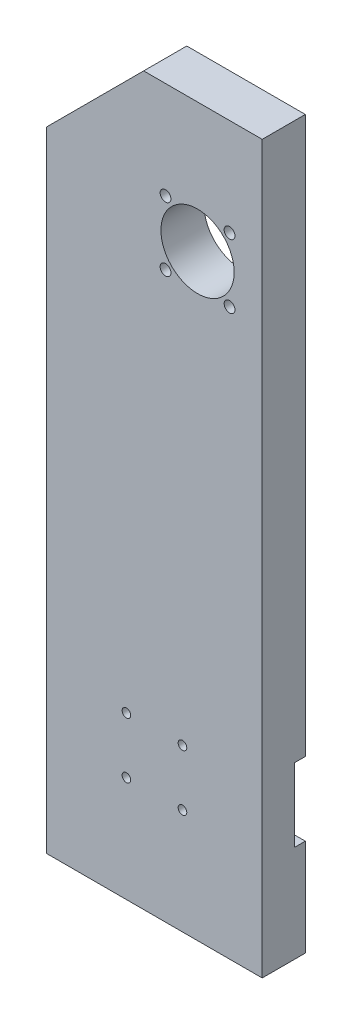
from build123d import *

# Parameters (mm, degrees)
SKETCH1_W           = 100
SKETCH1_H           = 337
SKETCH1_R           = 17
SKETCH1_R_2         = 2.5
SKETCH1_R_3         = 2
BOSS_EXTRUDE1_DEPTH = 20
CHAMFER1_SIZE       = 45
SKETCH2_W           = 100
SKETCH2_H           = 34
CUT_EXTRUDE1_DEPTH  = 5


with BuildPart() as part:
    # Sketch1 → Boss-Extrude1 (new body)
    with BuildSketch(Plane.XY):
        with Locations((47.704546062, 452.000370419)):
            Rectangle(SKETCH1_W, SKETCH1_H)
        with Locations((67.704546062, 560.500370419)):
            Circle(SKETCH1_R, mode=Mode.SUBTRACT)
        with Locations((82.553788467, 575.349612824)):
            Circle(SKETCH1_R_2, mode=Mode.SUBTRACT)
        with Locations((82.553788467, 545.651128014)):
            Circle(SKETCH1_R_2, mode=Mode.SUBTRACT)
        with Locations((52.855303657, 545.651128014)):
            Circle(SKETCH1_R_2, mode=Mode.SUBTRACT)
        with Locations((52.855303657, 575.349612824)):
            Circle(SKETCH1_R_2, mode=Mode.SUBTRACT)
        with Locations((34.704546062, 358.500370419)):
            Circle(SKETCH1_R_3, mode=Mode.SUBTRACT)
        with Locations(Location((60.704546062, 358.500370419, 0), (0, 0, 180))):
            Circle(SKETCH1_R_3, mode=Mode.SUBTRACT)
        with Locations((60.704546062, 332.500370419)):
            Circle(SKETCH1_R_3, mode=Mode.SUBTRACT)
        with Locations(Location((34.704546062, 332.500370419, 0), (0, 0, 180))):
            Circle(SKETCH1_R_3, mode=Mode.SUBTRACT)
    extrude(amount=BOSS_EXTRUDE1_DEPTH)

    # Chamfer1
    chamfer1_edges = [part.edges().sort_by_distance(p)[0] for p in [
        (-2.295453938, 620.500370419, 10),
    ]]
    chamfer(chamfer1_edges, length=CHAMFER1_SIZE)

    # Sketch2 → Cut-Extrude1 (cut)
    with BuildSketch(Plane.XY):
        with Locations((47.704546062, 345.500370419)):
            Rectangle(SKETCH2_W, SKETCH2_H)
    extrude(amount=CUT_EXTRUDE1_DEPTH, mode=Mode.SUBTRACT)


solid = part.part
